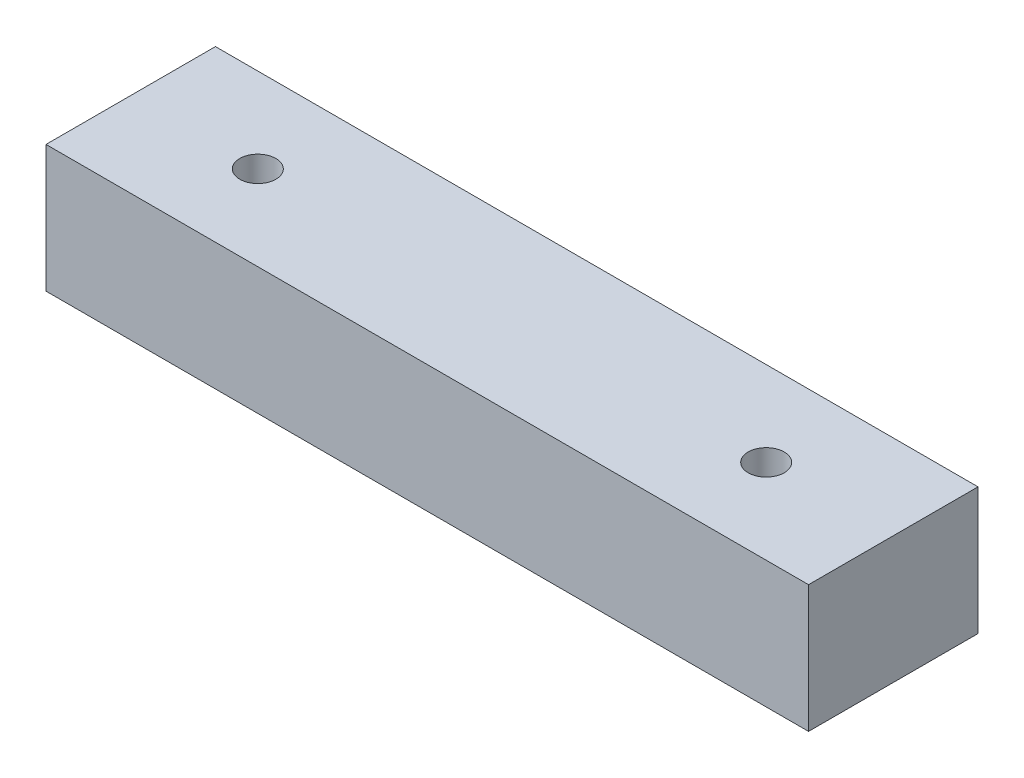
from build123d import *

# Parameters (mm, degrees)
SKETCH1_W             = 57.15
SKETCH1_H             = 12.7
BOSS_EXTRUDE1_DEPTH   = 9.525
F_6_32_TAPPED_HOLE1_D = 2.7051


with BuildPart() as part:
    # Sketch1 → Boss-Extrude1 (new body)
    with BuildSketch(Plane(origin=(0, 0, 0), x_dir=(1, 0, 0), z_dir=(0, 1, 0))):
        Rectangle(SKETCH1_W, SKETCH1_H)
    extrude(amount=BOSS_EXTRUDE1_DEPTH)

    # #6-32 Tapped Hole1 (through all)
    with Locations(Plane.XZ):
        with Locations((19.05, 0), (-19.05, 0)):
            Hole(F_6_32_TAPPED_HOLE1_D / 2)


solid = part.part
